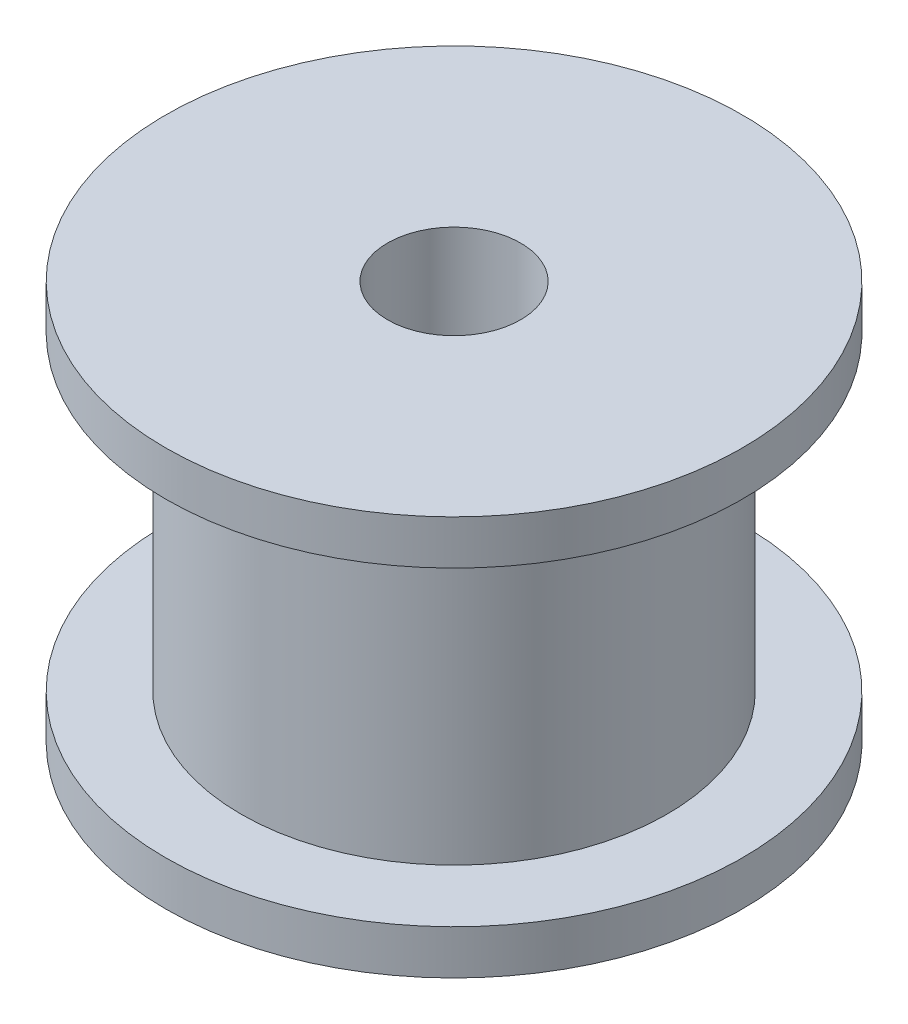
from build123d import *

# Parameters (mm, degrees)
SKETCH1_R           = 6.5
SKETCH1_R_2         = 1.5
BOSS_EXTRUDE1_DEPTH = 1
SKETCH2_R           = 4.8
SKETCH2_R_2         = 1.5
BOSS_EXTRUDE2_DEPTH = 7
SKETCH3_R           = 6.5
SKETCH3_R_2         = 1.5
BOSS_EXTRUDE3_DEPTH = 1


with BuildPart() as part:
    # Sketch1 → Boss-Extrude1 (new body)
    with BuildSketch(Plane(origin=(0, 0, 0), x_dir=(1, 0, 0), z_dir=(0, 1, 0))):
        with Locations(Location((0, 0, 0), (0, 0, 270))):
            Circle(SKETCH1_R)
        with Locations(Location((0, 0, 0), (0, 0, 270))):
            Circle(SKETCH1_R_2, mode=Mode.SUBTRACT)
    extrude(amount=BOSS_EXTRUDE1_DEPTH)

    # Sketch2 → Boss-Extrude2 (add)
    with BuildSketch(Plane(origin=(0, 1, 0), x_dir=(1, 0, 0), z_dir=(0, 1, 0))):
        with Locations(Location((0, 0, 0), (0, 0, 270))):
            Circle(SKETCH2_R)
        with Locations(Location((0, 0, 0), (0, 0, 270))):
            Circle(SKETCH2_R_2, mode=Mode.SUBTRACT)
    extrude(amount=BOSS_EXTRUDE2_DEPTH)

    # Sketch3 → Boss-Extrude3 (add)
    with BuildSketch(Plane(origin=(0, 8, 0), x_dir=(1, 0, 0), z_dir=(0, 1, 0))):
        with Locations(Location((0, 0, 0), (0, 0, 270))):
            Circle(SKETCH3_R)
        with Locations(Location((0, 0, 0), (0, 0, 270))):
            Circle(SKETCH3_R_2, mode=Mode.SUBTRACT)
    extrude(amount=BOSS_EXTRUDE3_DEPTH)


solid = part.part
